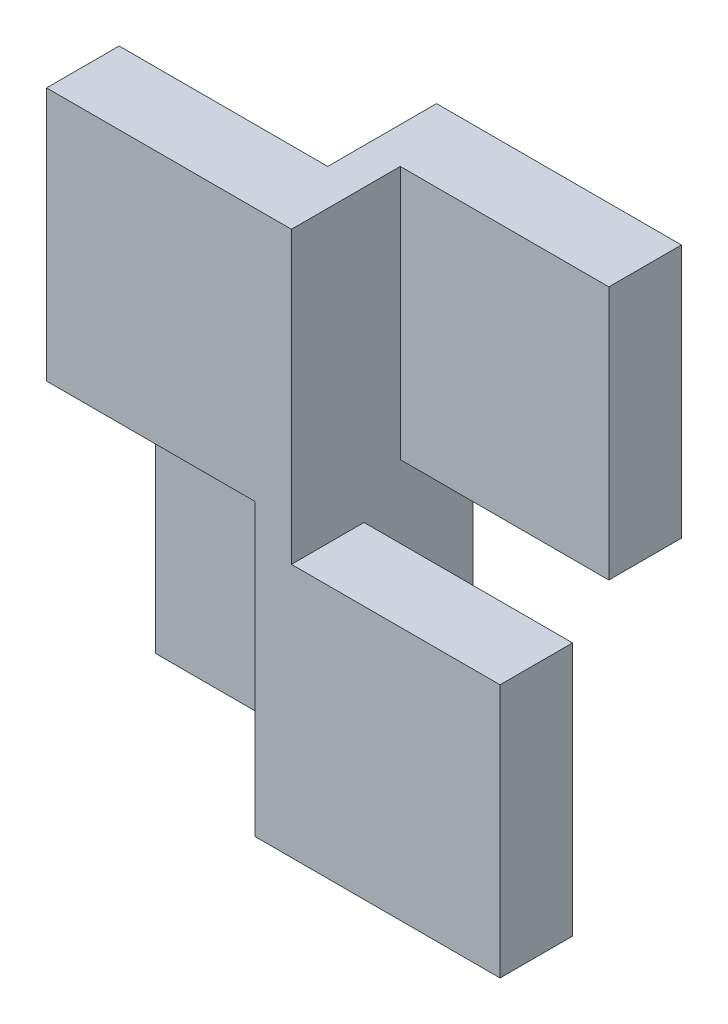
from build123d import *

# Parameters (mm, degrees)
SKETCH1_W           = 0.25
SKETCH1_H           = 0.3
BOSS_EXTRUDE1_DEPTH = 0.1
CUT_EXTRUDE1_DEPTH  = 0.115
CUT_EXTRUDE2_DEPTH  = 0.115


with BuildPart() as part:
    # Sketch1 → Boss-Extrude1 (new body)
    with BuildSketch(Plane.XY):
        with Locations((0.125, 0.15)):
            Rectangle(SKETCH1_W, SKETCH1_H)
    extrude(amount=BOSS_EXTRUDE1_DEPTH)

    # Sketch2 → Cut-Extrude1 (cut)
    with BuildSketch(Plane.ZY):
        Polygon((0, 0.3), (0.06, 0.3), (0.06, 0.16), (0.1, 0.16), (0.1, 0), (0.04, 0), (0.04, 0.14), (0, 0.14), align=None)
    extrude(amount=-CUT_EXTRUDE1_DEPTH, mode=Mode.SUBTRACT)

    # Sketch4 → Cut-Extrude2 (cut)
    with BuildSketch(Plane(origin=(0.25, 0, 0), x_dir=(0, 0, -1), z_dir=(1, 0, 0))):
        Polygon((-0.1, 0.14), (-0.1, 0.3), (-0.04, 0.3), (-0.04, 0.16), (0, 0.16), (0, 0), (-0.06, 0), (-0.06, 0.14), align=None)
    extrude(amount=-CUT_EXTRUDE2_DEPTH, mode=Mode.SUBTRACT)


solid = part.part
